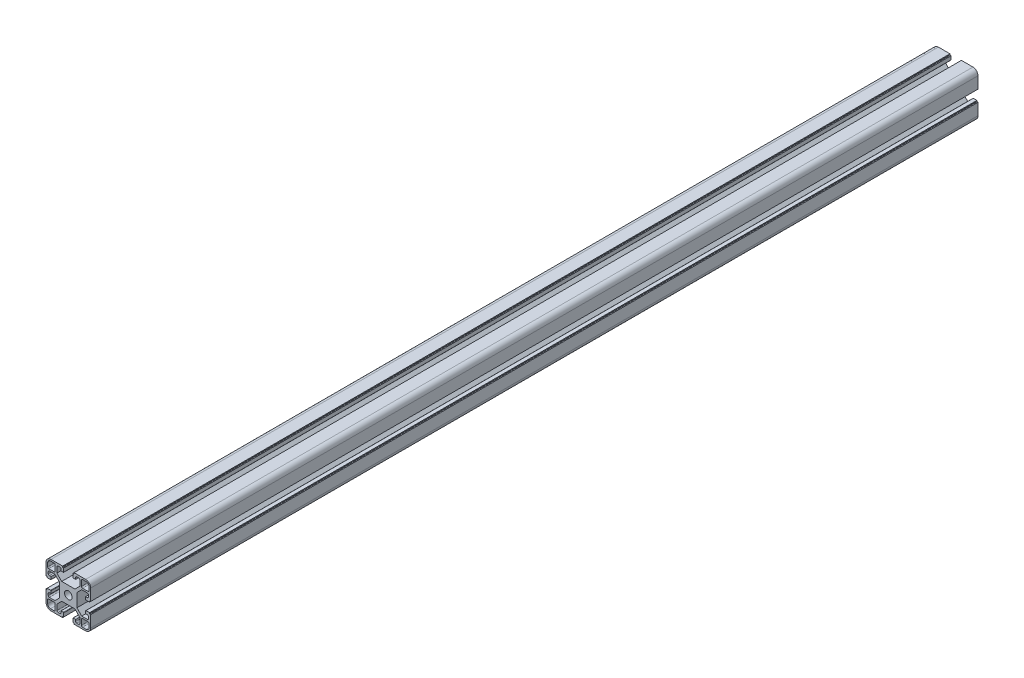
from build123d import *

# Parameters (mm, degrees)
SKETCH_1_R      = 3.4
EXTRUDE_1_DEPTH = 795


with BuildPart() as part:
    # 草图1 → 凸台-拉伸1 (new body)
    with BuildSketch(Plane.XY):
        with BuildLine():
            Line((-1.911920332, 0.735190406), (2.405846621, 5.052957359))
            Line((2.405846621, 5.052957359), (7.388079668, 5.052957359))
            ThreePointArc((7.388079668, 5.052957359), (8.09518645, 4.76006414), (8.388079668, 4.052957359))
            Line((8.388079668, 4.052957359), (8.388079668, 2.402957359))
            ThreePointArc((8.388079668, 2.402957359), (8.09518645, 1.695850578), (7.388079668, 1.402957359))
            Line((7.388079668, 1.402957359), (5.888079668, 1.402957359))
            Line((5.888079668, 1.402957359), (5.888079668, -0.797042641))
            ThreePointArc((5.888079668, -0.797042641), (5.975947634, -1.009174675), (6.188079668, -1.097042641))
            Line((6.188079668, -1.097042641), (9.388079668, -1.097042641))
            Line((9.388079668, -1.097042641), (9.388079668, -0.297042641))
            ThreePointArc((9.388079668, -0.297042641), (9.446658312, -0.155621285), (9.588079668, -0.097042641))
            Line((9.588079668, -0.097042641), (10.388079668, -0.097042641))
            Line((10.388079668, -0.097042641), (10.388079668, 10.302957359))
            ThreePointArc((10.388079668, 10.302957359), (9.070060184, 13.484937874), (5.888079668, 14.802957359))
            Line((5.888079668, 14.802957359), (-4.511920332, 14.802957359))
            Line((-4.511920332, 14.802957359), (-4.511920332, 14.002957359))
            ThreePointArc((-4.511920332, 14.002957359), (-4.570498975, 13.861536003), (-4.711920332, 13.802957359))
            Line((-4.711920332, 13.802957359), (-5.511920332, 13.802957359))
            Line((-5.511920332, 13.802957359), (-5.511920332, 10.602957359))
            ThreePointArc((-5.511920332, 10.602957359), (-5.424052366, 10.390825325), (-5.211920332, 10.302957359))
            Line((-5.211920332, 10.302957359), (-3.011920332, 10.302957359))
            Line((-3.011920332, 10.302957359), (-3.011920332, 11.802957359))
            ThreePointArc((-3.011920332, 11.802957359), (-2.719027113, 12.51006414), (-2.011920332, 12.802957359))
            Line((-2.011920332, 12.802957359), (-0.361920332, 12.802957359))
            ThreePointArc((-0.361920332, 12.802957359), (0.34518645, 12.51006414), (0.638079668, 11.802957359))
            Line((0.638079668, 11.802957359), (0.638079668, 6.820724312))
            Line((0.638079668, 6.820724312), (-3.679687285, 2.502957359))
            Line((-3.679687285, 2.502957359), (-15.544153379, 2.502957359))
            Line((-15.544153379, 2.502957359), (-19.861920332, 6.820724312))
            Line((-19.861920332, 6.820724312), (-19.861920332, 11.802957359))
            ThreePointArc((-19.861920332, 11.802957359), (-19.569027113, 12.51006414), (-18.861920332, 12.802957359))
            Line((-18.861920332, 12.802957359), (-17.211920332, 12.802957359))
            ThreePointArc((-17.211920332, 12.802957359), (-16.50481355, 12.51006414), (-16.211920332, 11.802957359))
            Line((-16.211920332, 11.802957359), (-16.211920332, 10.302957359))
            Line((-16.211920332, 10.302957359), (-14.011920332, 10.302957359))
            ThreePointArc((-14.011920332, 10.302957359), (-13.799788297, 10.390825325), (-13.711920332, 10.602957359))
            Line((-13.711920332, 10.602957359), (-13.711920332, 13.802957359))
            Line((-13.711920332, 13.802957359), (-14.511920332, 13.802957359))
            ThreePointArc((-14.511920332, 13.802957359), (-14.653341688, 13.861536003), (-14.711920332, 14.002957359))
            Line((-14.711920332, 14.002957359), (-14.711920332, 14.802957359))
            Line((-14.711920332, 14.802957359), (-25.111920332, 14.802957359))
            ThreePointArc((-25.111920332, 14.802957359), (-28.293900847, 13.484937874), (-29.611920332, 10.302957359))
            Line((-29.611920332, 10.302957359), (-29.611920332, -0.097042641))
            Line((-29.611920332, -0.097042641), (-28.811920332, -0.097042641))
            ThreePointArc((-28.811920332, -0.097042641), (-28.670498975, -0.155621285), (-28.611920332, -0.297042641))
            Line((-28.611920332, -0.297042641), (-28.611920332, -1.097042641))
            Line((-28.611920332, -1.097042641), (-25.411920332, -1.097042641))
            ThreePointArc((-25.411920332, -1.097042641), (-25.199788297, -1.009174675), (-25.111920332, -0.797042641))
            Line((-25.111920332, -0.797042641), (-25.111920332, 1.402957359))
            Line((-25.111920332, 1.402957359), (-26.611920332, 1.402957359))
            ThreePointArc((-26.611920332, 1.402957359), (-27.319027113, 1.695850578), (-27.611920332, 2.402957359))
            Line((-27.611920332, 2.402957359), (-27.611920332, 4.052957359))
            ThreePointArc((-27.611920332, 4.052957359), (-27.319027113, 4.76006414), (-26.611920332, 5.052957359))
            Line((-26.611920332, 5.052957359), (-21.629687285, 5.052957359))
            Line((-21.629687285, 5.052957359), (-17.311920332, 0.735190406))
            Line((-17.311920332, 0.735190406), (-17.311920332, -11.129275688))
            Line((-17.311920332, -11.129275688), (-21.629687285, -15.447042641))
            Line((-21.629687285, -15.447042641), (-26.611920332, -15.447042641))
            ThreePointArc((-26.611920332, -15.447042641), (-27.319027113, -15.154149422), (-27.611920332, -14.447042641))
            Line((-27.611920332, -14.447042641), (-27.611920332, -12.797042641))
            ThreePointArc((-27.611920332, -12.797042641), (-27.319027113, -12.08993586), (-26.611920332, -11.797042641))
            Line((-26.611920332, -11.797042641), (-25.111920332, -11.797042641))
            Line((-25.111920332, -11.797042641), (-25.111920332, -9.597042641))
            ThreePointArc((-25.111920332, -9.597042641), (-25.199788297, -9.384910607), (-25.411920332, -9.297042641))
            Line((-25.411920332, -9.297042641), (-28.611920332, -9.297042641))
            Line((-28.611920332, -9.297042641), (-28.611920332, -10.097042641))
            ThreePointArc((-28.611920332, -10.097042641), (-28.670498975, -10.238463997), (-28.811920332, -10.297042641))
            Line((-28.811920332, -10.297042641), (-29.611920332, -10.297042641))
            Line((-29.611920332, -10.297042641), (-29.611920332, -20.697042641))
            ThreePointArc((-29.611920332, -20.697042641), (-28.293900847, -23.879023156), (-25.111920332, -25.197042641))
            Line((-25.111920332, -25.197042641), (-14.711920332, -25.197042641))
            Line((-14.711920332, -25.197042641), (-14.711920332, -24.397042641))
            ThreePointArc((-14.711920332, -24.397042641), (-14.653341688, -24.255621285), (-14.511920332, -24.197042641))
            Line((-14.511920332, -24.197042641), (-13.711920332, -24.197042641))
            Line((-13.711920332, -24.197042641), (-13.711920332, -20.997042641))
            ThreePointArc((-13.711920332, -20.997042641), (-13.799788297, -20.784910607), (-14.011920332, -20.697042641))
            Line((-14.011920332, -20.697042641), (-16.211920332, -20.697042641))
            Line((-16.211920332, -20.697042641), (-16.211920332, -22.197042641))
            ThreePointArc((-16.211920332, -22.197042641), (-16.50481355, -22.904149422), (-17.211920332, -23.197042641))
            Line((-17.211920332, -23.197042641), (-18.861920332, -23.197042641))
            ThreePointArc((-18.861920332, -23.197042641), (-19.569027113, -22.904149422), (-19.861920332, -22.197042641))
            Line((-19.861920332, -22.197042641), (-19.861920332, -17.214809594))
            Line((-19.861920332, -17.214809594), (-15.544153379, -12.897042641))
            Line((-15.544153379, -12.897042641), (-3.679687285, -12.897042641))
            Line((-3.679687285, -12.897042641), (0.638079668, -17.214809594))
            Line((0.638079668, -17.214809594), (0.638079668, -22.197042641))
            ThreePointArc((0.638079668, -22.197042641), (0.34518645, -22.904149422), (-0.361920332, -23.197042641))
            Line((-0.361920332, -23.197042641), (-2.011920332, -23.197042641))
            ThreePointArc((-2.011920332, -23.197042641), (-2.719027113, -22.904149422), (-3.011920332, -22.197042641))
            Line((-3.011920332, -22.197042641), (-3.011920332, -20.697042641))
            Line((-3.011920332, -20.697042641), (-5.211920332, -20.697042641))
            ThreePointArc((-5.211920332, -20.697042641), (-5.424052366, -20.784910607), (-5.511920332, -20.997042641))
            Line((-5.511920332, -20.997042641), (-5.511920332, -24.197042641))
            Line((-5.511920332, -24.197042641), (-4.711920332, -24.197042641))
            ThreePointArc((-4.711920332, -24.197042641), (-4.570498975, -24.255621285), (-4.511920332, -24.397042641))
            Line((-4.511920332, -24.397042641), (-4.511920332, -25.197042641))
            Line((-4.511920332, -25.197042641), (5.888079668, -25.197042641))
            ThreePointArc((5.888079668, -25.197042641), (9.070060184, -23.879023156), (10.388079668, -20.697042641))
            Line((10.388079668, -20.697042641), (10.388079668, -10.297042641))
            Line((10.388079668, -10.297042641), (9.588079668, -10.297042641))
            ThreePointArc((9.588079668, -10.297042641), (9.446658312, -10.238463997), (9.388079668, -10.097042641))
            Line((9.388079668, -10.097042641), (9.388079668, -9.297042641))
            Line((9.388079668, -9.297042641), (6.188079668, -9.297042641))
            ThreePointArc((6.188079668, -9.297042641), (5.975947634, -9.384910607), (5.888079668, -9.597042641))
            Line((5.888079668, -9.597042641), (5.888079668, -11.797042641))
            Line((5.888079668, -11.797042641), (7.388079668, -11.797042641))
            ThreePointArc((7.388079668, -11.797042641), (8.09518645, -12.08993586), (8.388079668, -12.797042641))
            Line((8.388079668, -12.797042641), (8.388079668, -14.447042641))
            ThreePointArc((8.388079668, -14.447042641), (8.09518645, -15.154149422), (7.388079668, -15.447042641))
            Line((7.388079668, -15.447042641), (2.405846621, -15.447042641))
            Line((2.405846621, -15.447042641), (-1.911920332, -11.129275688))
            Line((-1.911920332, -11.129275688), (-1.911920332, 0.735190406))
        make_face()
        with Locations((-9.611920332, -5.197042641)):
            Circle(SKETCH_1_R, mode=Mode.SUBTRACT)
        with BuildLine():
            Line((3.138079668, -16.947042641), (7.892079668, -16.947042641))
            ThreePointArc((7.892079668, -16.947042641), (8.59918645, -17.23993586), (8.892079668, -17.947042641))
            Line((8.892079668, -17.947042641), (8.892079668, -21.201042641))
            ThreePointArc((8.892079668, -21.201042641), (8.159846621, -22.968809594), (6.392079668, -23.701042641))
            Line((6.392079668, -23.701042641), (3.138079668, -23.701042641))
            ThreePointArc((3.138079668, -23.701042641), (2.430972887, -23.408149422), (2.138079668, -22.701042641))
            Line((2.138079668, -22.701042641), (2.138079668, -17.947042641))
            ThreePointArc((2.138079668, -17.947042641), (2.430972887, -17.23993586), (3.138079668, -16.947042641))
        make_face(mode=Mode.SUBTRACT)
        with BuildLine():
            Line((-21.361920332, -17.947042641), (-21.361920332, -22.701042641))
            ThreePointArc((-21.361920332, -22.701042641), (-21.65481355, -23.408149422), (-22.361920332, -23.701042641))
            Line((-22.361920332, -23.701042641), (-25.615920332, -23.701042641))
            ThreePointArc((-25.615920332, -23.701042641), (-27.383687285, -22.968809594), (-28.115920332, -21.201042641))
            Line((-28.115920332, -21.201042641), (-28.115920332, -17.947042641))
            ThreePointArc((-28.115920332, -17.947042641), (-27.823027113, -17.23993586), (-27.115920332, -16.947042641))
            Line((-27.115920332, -16.947042641), (-22.361920332, -16.947042641))
            ThreePointArc((-22.361920332, -16.947042641), (-21.65481355, -17.23993586), (-21.361920332, -17.947042641))
        make_face(mode=Mode.SUBTRACT)
        with BuildLine():
            Line((2.138079668, 7.552957359), (2.138079668, 12.306957359))
            ThreePointArc((2.138079668, 12.306957359), (2.430972887, 13.01406414), (3.138079668, 13.306957359))
            Line((3.138079668, 13.306957359), (6.392079668, 13.306957359))
            ThreePointArc((6.392079668, 13.306957359), (8.159846621, 12.574724312), (8.892079668, 10.806957359))
            Line((8.892079668, 10.806957359), (8.892079668, 7.552957359))
            ThreePointArc((8.892079668, 7.552957359), (8.59918645, 6.845850578), (7.892079668, 6.552957359))
            Line((7.892079668, 6.552957359), (3.138079668, 6.552957359))
            ThreePointArc((3.138079668, 6.552957359), (2.430972887, 6.845850578), (2.138079668, 7.552957359))
        make_face(mode=Mode.SUBTRACT)
        with BuildLine():
            Line((-22.361920332, 6.552957359), (-27.115920332, 6.552957359))
            ThreePointArc((-27.115920332, 6.552957359), (-27.823027113, 6.845850578), (-28.115920332, 7.552957359))
            Line((-28.115920332, 7.552957359), (-28.115920332, 10.806957359))
            ThreePointArc((-28.115920332, 10.806957359), (-27.383687285, 12.574724312), (-25.615920332, 13.306957359))
            Line((-25.615920332, 13.306957359), (-22.361920332, 13.306957359))
            ThreePointArc((-22.361920332, 13.306957359), (-21.65481355, 13.01406414), (-21.361920332, 12.306957359))
            Line((-21.361920332, 12.306957359), (-21.361920332, 7.552957359))
            ThreePointArc((-21.361920332, 7.552957359), (-21.65481355, 6.845850578), (-22.361920332, 6.552957359))
        make_face(mode=Mode.SUBTRACT)
    extrude(amount=EXTRUDE_1_DEPTH)


solid = part.part
